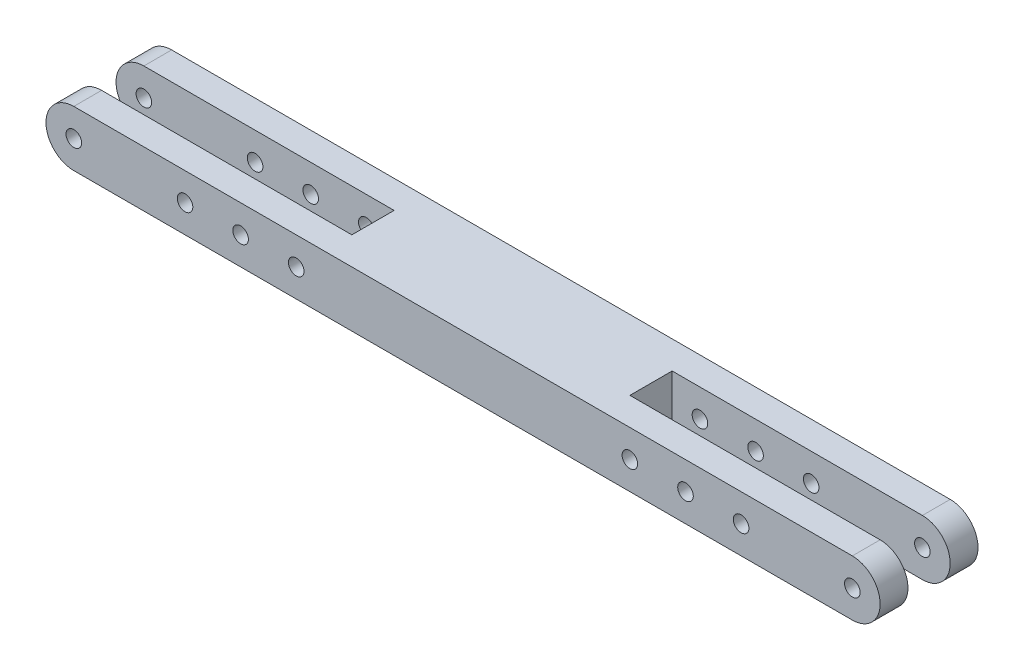
from build123d import *

# Parameters (mm, degrees)
SKETCH2_R               = 1.778
BOSS_EXTRUDE1_DEPTH     = 22.352
CUT_EXTRUDE1_DEPTH      = 186.610228447
CUT_EXTRUDE1_DEPTH_BACK = 186.610228447
SKETCH3_W               = 63.5
SKETCH3_H               = 9.652


with BuildPart() as part:
    # Sketch2 → Boss-Extrude1 (new body)
    with BuildSketch(Plane.XY):
        with BuildLine():
            Line((0, 6.35), (177.8, 6.35))
            ThreePointArc((177.8, 6.35), (184.15, 0), (177.8, -6.35))
            Line((177.8, -6.35), (0, -6.35))
            ThreePointArc((0, -6.35), (-6.35, 0), (0, 6.35))
        make_face()
        Circle(SKETCH2_R, mode=Mode.SUBTRACT)
        with Locations((25.4, 0)):
            Circle(SKETCH2_R, mode=Mode.SUBTRACT)
        with Locations((38.1, 0)):
            Circle(SKETCH2_R, mode=Mode.SUBTRACT)
        with Locations((50.8, 0)):
            Circle(SKETCH2_R, mode=Mode.SUBTRACT)
        with Locations(Location((127, 0, 0), (0, 0, 180))):
            Circle(SKETCH2_R, mode=Mode.SUBTRACT)
        with Locations(Location((139.7, 0, 0), (0, 0, 180))):
            Circle(SKETCH2_R, mode=Mode.SUBTRACT)
        with Locations(Location((152.4, 0, 0), (0, 0, 180))):
            Circle(SKETCH2_R, mode=Mode.SUBTRACT)
        with Locations(Location((177.8, 0, 0), (0, 0, 180))):
            Circle(SKETCH2_R, mode=Mode.SUBTRACT)
    extrude(amount=BOSS_EXTRUDE1_DEPTH)

    # Sketch3 → Cut-Extrude1 (cut, two sides: drawn at the far end of the back side and taken through both)
    with BuildSketch(Plane(origin=(0, 0, 0), x_dir=(1, 0, 0), z_dir=(0, 1, 0)).offset(-CUT_EXTRUDE1_DEPTH_BACK)):
        with Locations((25.4, -11.176)):
            Rectangle(SKETCH3_W, SKETCH3_H)
        with Locations((152.4, -11.176)):
            Rectangle(SKETCH3_W, SKETCH3_H)
    extrude(amount=CUT_EXTRUDE1_DEPTH + CUT_EXTRUDE1_DEPTH_BACK, mode=Mode.SUBTRACT)


solid = part.part
